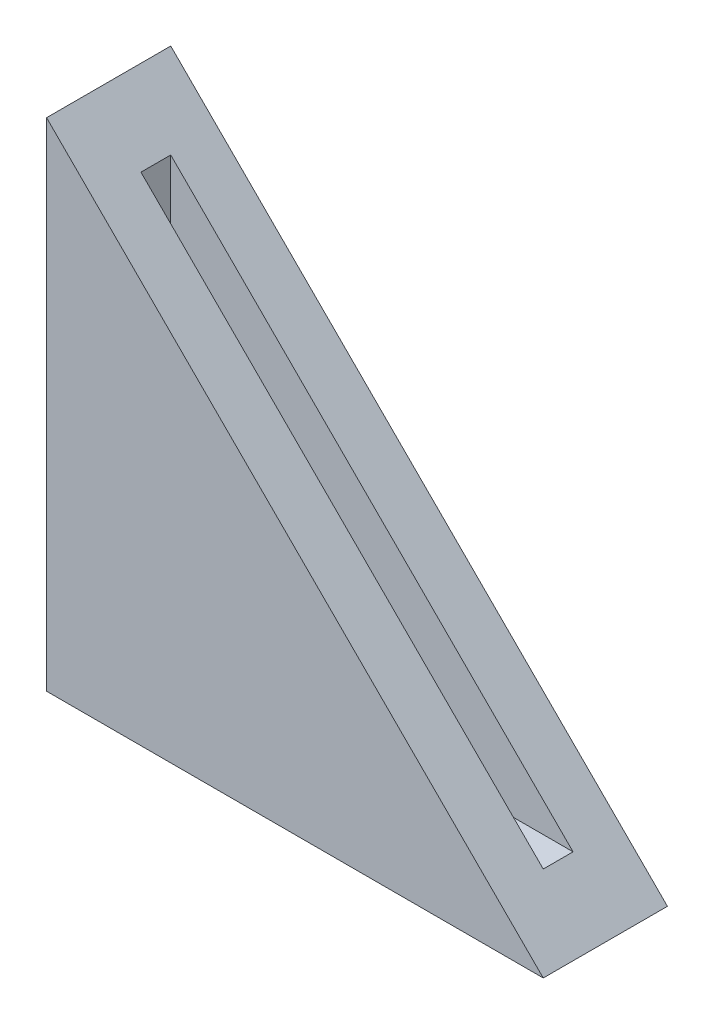
from build123d import *

# Parameters (mm, degrees)
BOSS_EXTRU_1_DEPTH           = 7.5
BOSS_EXTRU_2_DEPTH           = 7.5
ENL_V_MAT_EXTRU_1_DEPTH      = 1.8
ENL_V_MAT_EXTRU_1_DEPTH_BACK = 1.8


with BuildPart() as part:
    # Esquisse1 → Boss.-Extru.1 (new body)
    with BuildSketch(Plane.XY):
        Polygon((0, 0), (0, 60), (60, 0), align=None)
    extrude(amount=BOSS_EXTRU_1_DEPTH)

    # Esquisse4 → Boss.-Extru.2 (add)
    with BuildSketch(Plane(origin=(0, 0, 0), x_dir=(-1, 0, 0), z_dir=(0, 0, -1))):
        Polygon((-60, 0), (0, 0), (0, 60), align=None)
    extrude(amount=BOSS_EXTRU_2_DEPTH)

    # Esquisse5 → Enlèv. mat.-Extru.1 (cut, two sides: drawn at the far end of the back side and taken through both)
    with BuildSketch(Plane.XY.offset(-ENL_V_MAT_EXTRU_1_DEPTH_BACK)):
        Polygon((19.799886626, 5.7), (65.41074544, 5.7), (5.7, 61.280925076), (5.7, 19.989141186), (5.7, 5.7), align=None)
    extrude(amount=ENL_V_MAT_EXTRU_1_DEPTH + ENL_V_MAT_EXTRU_1_DEPTH_BACK, mode=Mode.SUBTRACT)


solid = part.part
